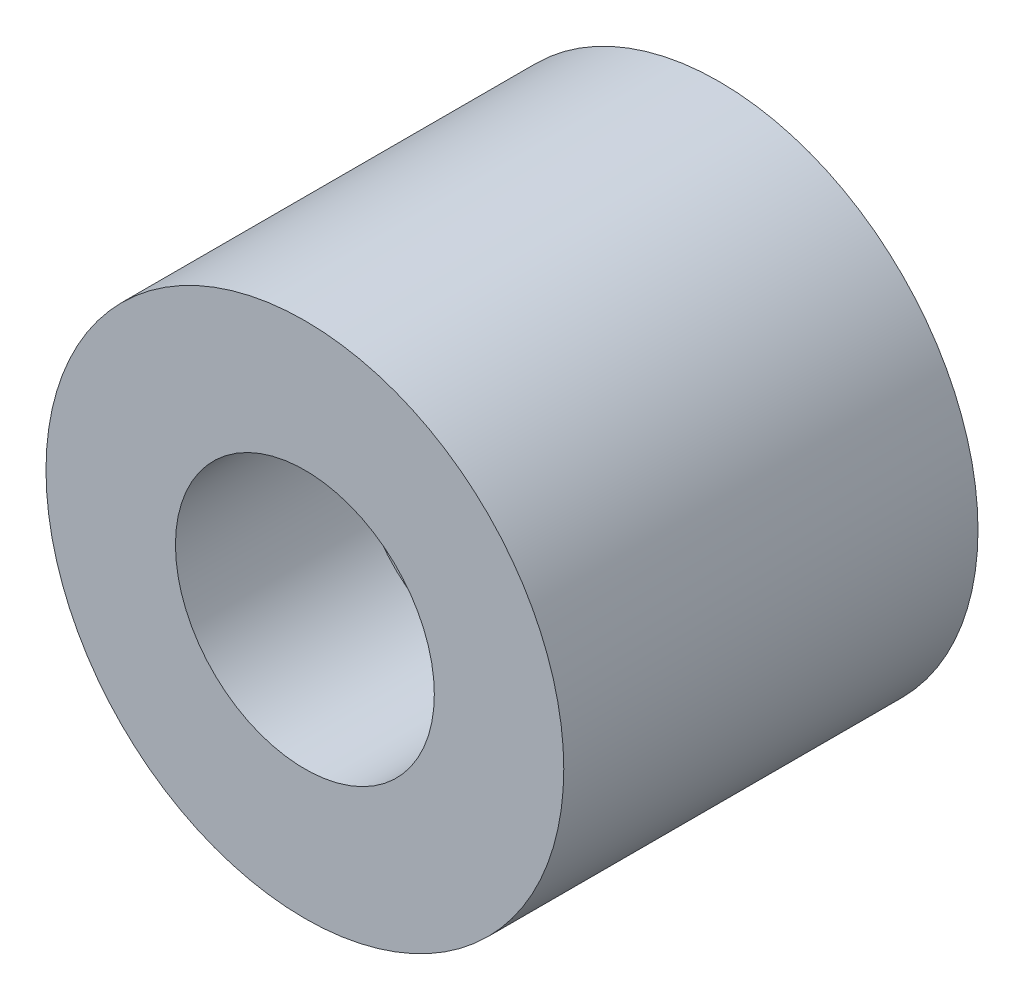
from build123d import *

# Parameters (mm, degrees)
SKETCH1_R           = 6.35
BOSS_EXTRUDE1_DEPTH = 10.16
SKETCH2_R           = 3.175
CUT_EXTRUDE1_DEPTH  = 4.445
SKETCH3_R           = 2.921
CUT_EXTRUDE2_DEPTH  = 4.445


with BuildPart() as part:
    # Sketch1 → Boss-Extrude1 (new body)
    with BuildSketch(Plane.XY):
        Circle(SKETCH1_R)
    extrude(amount=BOSS_EXTRUDE1_DEPTH)

    # Sketch2 → Cut-Extrude1 (cut)
    with BuildSketch(Plane.XY.offset(10.16)):
        Circle(SKETCH2_R)
    extrude(amount=-CUT_EXTRUDE1_DEPTH, mode=Mode.SUBTRACT)

    # Sketch3 → Cut-Extrude2 (cut)
    with BuildSketch(Plane(origin=(0, 0, 0), x_dir=(-1, 0, 0), z_dir=(0, 0, -1))):
        Circle(SKETCH3_R)
    extrude(amount=-CUT_EXTRUDE2_DEPTH, mode=Mode.SUBTRACT)


solid = part.part
